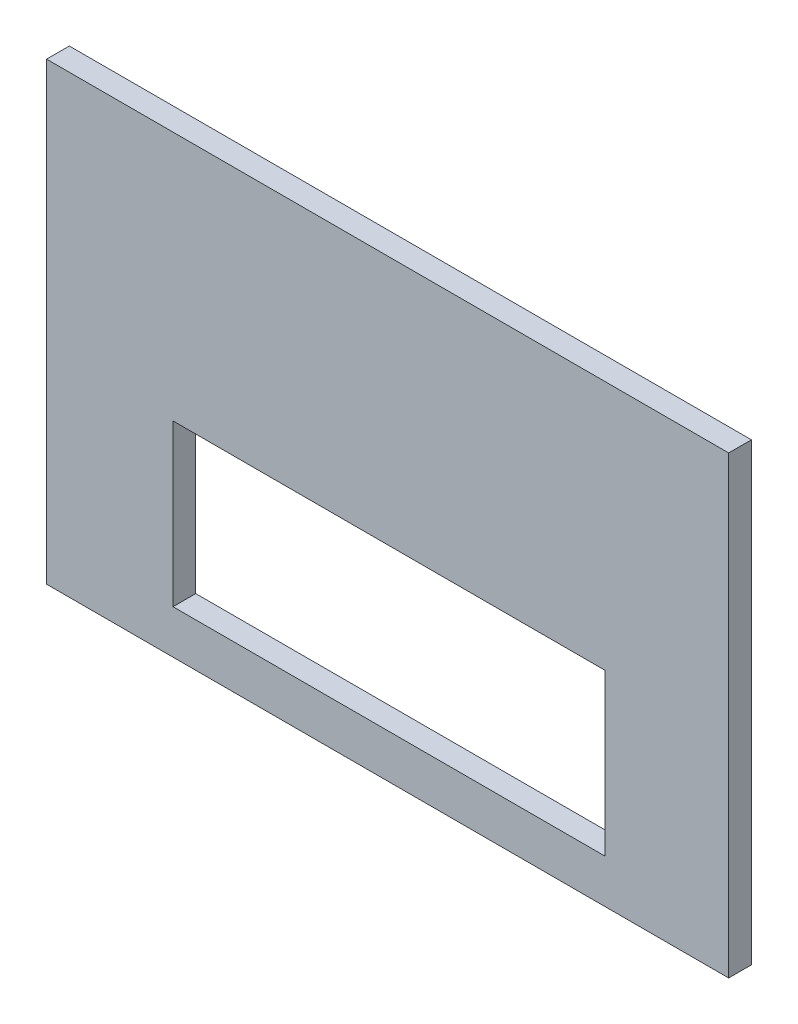
from build123d import *

# Parameters (mm, degrees)
SKETCH1_W           = 300
SKETCH1_H           = 200
SKETCH1_W_2         = 190.074893059
SKETCH1_H_2         = 70.777485738
BOSS_EXTRUDE1_DEPTH = 10


with BuildPart() as part:
    # Sketch1 → Boss-Extrude1 (new body)
    with BuildSketch(Plane.XY):
        with Locations((134.615384615, -4.807692308)):
            Rectangle(SKETCH1_W, SKETCH1_H)
        with Locations((135.257161408, -50.196435177)):
            Rectangle(SKETCH1_W_2, SKETCH1_H_2, mode=Mode.SUBTRACT)
    extrude(amount=BOSS_EXTRUDE1_DEPTH)


solid = part.part
